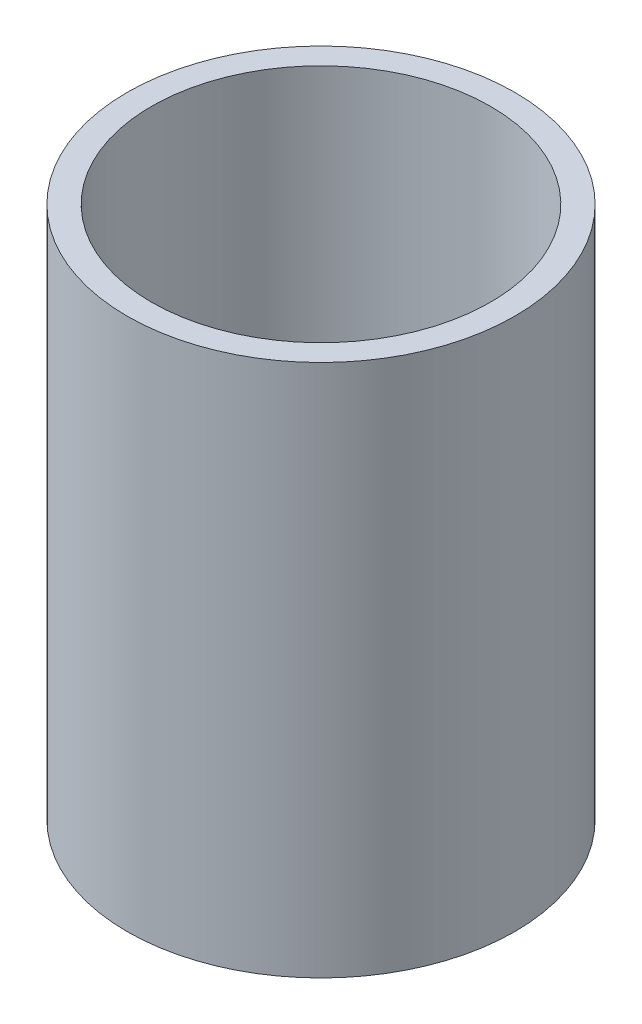
from build123d import *

# Parameters (mm, degrees)
SKETCH1_R           = 40
SKETCH1_R_2         = 35
BOSS_EXTRUDE1_DEPTH = 55


with BuildPart() as part:
    # Sketch1 → Boss-Extrude1 (new, symmetric)
    with BuildSketch(Plane(origin=(0, 0, 0), x_dir=(1, 0, 0), z_dir=(0, 1, 0))):
        with Locations(Location((0, 0, 0), (0, 0, 270))):
            Circle(SKETCH1_R)
        with Locations(Location((0, 0, 0), (0, 0, 270))):
            Circle(SKETCH1_R_2, mode=Mode.SUBTRACT)
    extrude(amount=BOSS_EXTRUDE1_DEPTH, both=True)


solid = part.part
